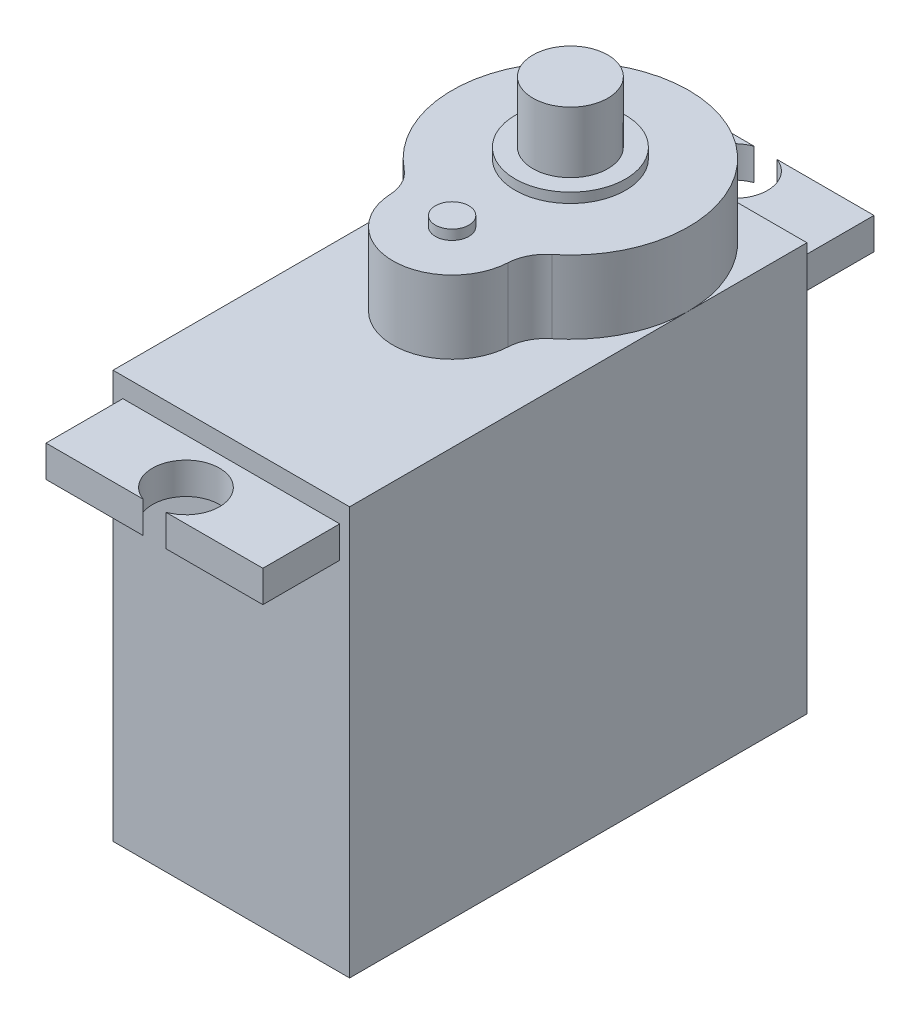
from build123d import *

# Parameters (mm, degrees)
SKETCH1_W                = 12
SKETCH1_H                = 23.2
BOSS_EXTRUDE1_DEPTH      = 20.7
SKETCH2_W                = 11
SKETCH2_H                = 1.6
BOSS_EXTRUDE2_DEPTH      = 3.9
SKETCH3_W                = 11
SKETCH3_H                = 1.6
BOSS_EXTRUDE3_DEPTH      = 3.9
SKETCH4_R                = 6
BOSS_EXTRUDE4_DEPTH      = 3.7
SKETCH5_R                = 3
BOSS_EXTRUDE5_DEPTH      = 3.7
FILLET1_R                = 2
SKETCH6_R                = 0.85
BOSS_EXTRUDE6_DEPTH      = 0.5
SKETCH7_R                = 2.8
BOSS_EXTRUDE7_DEPTH      = 0.5
SKETCH8_R                = 1.9
BOSS_EXTRUDE8_DEPTH      = 3.1
M3_CLEARANCE_HOLE1_D     = 3.4
M3_CLEARANCE_HOLE1_DEPTH = 3
M3_CLEARANCE_HOLE1_TIP   = 1.021463052
SKETCH11_R               = 0.5
BOSS_EXTRUDE9_DEPTH      = 3
LPATTERN2_COUNT          = 3
LPATTERN2_PITCH          = 1.01


with BuildPart() as part:
    # Sketch1 → Boss-Extrude1 (new body)
    with BuildSketch(Plane(origin=(0, 0, 0), x_dir=(1, 0, 0), z_dir=(0, 1, 0))):
        with Locations((6, 11.6)):
            Rectangle(SKETCH1_W, SKETCH1_H)
    extrude(amount=BOSS_EXTRUDE1_DEPTH)

    # Sketch2 → Boss-Extrude2 (add)
    with BuildSketch(Plane.XY):
        with Locations((6, 18.9)):
            Rectangle(SKETCH2_W, SKETCH2_H)
    extrude(amount=BOSS_EXTRUDE2_DEPTH)

    # Sketch3 → Boss-Extrude3 (add)
    with BuildSketch(Plane(origin=(0, 0, -23.2), x_dir=(-1, 0, 0), z_dir=(0, 0, -1))):
        with Locations((-6, 18.9)):
            Rectangle(SKETCH3_W, SKETCH3_H)
    extrude(amount=BOSS_EXTRUDE3_DEPTH)

    # Sketch4 → Boss-Extrude4 (add)
    with BuildSketch(Plane(origin=(0, 20.7, 0), x_dir=(1, 0, 0), z_dir=(0, 1, 0))):
        with Locations(Location((6, 17.2, 0), (0, 0, 90))):
            Circle(SKETCH4_R)
    extrude(amount=BOSS_EXTRUDE4_DEPTH)

    # Sketch5 → Boss-Extrude5 (add)
    with BuildSketch(Plane(origin=(0, 20.7, 0), x_dir=(1, 0, 0), z_dir=(0, 1, 0))):
        with Locations((6, 11.2)):
            Circle(SKETCH5_R)
    extrude(amount=BOSS_EXTRUDE5_DEPTH)

    # Fillet1
    fillet1_edges = [part.edges().sort_by_distance(p)[0] for p in [
        (3.09526249, 22.55, -11.95),
        (8.90473751, 22.55, -11.95),
    ]]
    fillet(fillet1_edges, radius=FILLET1_R)

    # Sketch6 → Boss-Extrude6 (add)
    with BuildSketch(Plane(origin=(0, 24.4, 0), x_dir=(1, 0, 0), z_dir=(0, 1, 0))):
        with Locations(Location((6, 11.2, 0), (0, 0, 270))):
            Circle(SKETCH6_R)
    extrude(amount=BOSS_EXTRUDE6_DEPTH)

    # Sketch7 → Boss-Extrude7 (add)
    with BuildSketch(Plane(origin=(0, 24.4, 0), x_dir=(1, 0, 0), z_dir=(0, 1, 0))):
        with Locations(Location((6, 17.2, 0), (0, 0, 270))):
            Circle(SKETCH7_R)
    extrude(amount=BOSS_EXTRUDE7_DEPTH)

    # Sketch8 → Boss-Extrude8 (add)
    with BuildSketch(Plane(origin=(0, 24.9, 0), x_dir=(1, 0, 0), z_dir=(0, 1, 0))):
        with Locations(Location((6, 17.2, 0), (0, 0, 90))):
            Circle(SKETCH8_R)
    extrude(amount=BOSS_EXTRUDE8_DEPTH)

    # M3 Clearance Hole1
    with Locations(Plane(origin=(0, 19.7, 0), x_dir=(1, 0, 0), z_dir=(0, 1, 0))):
        with Locations((6, -2.3), (6, 25.5)):
            Hole(M3_CLEARANCE_HOLE1_D / 2, depth=M3_CLEARANCE_HOLE1_DEPTH)
            with Locations((0, 0, -(M3_CLEARANCE_HOLE1_DEPTH + M3_CLEARANCE_HOLE1_TIP / 2))):  # 118° drill point
                Cone(0, M3_CLEARANCE_HOLE1_D / 2, M3_CLEARANCE_HOLE1_TIP, mode=Mode.SUBTRACT)

    # Sketch11 → Boss-Extrude9 (add)
    with BuildSketch(Plane(origin=(0, 0, -23.2), x_dir=(-1, 0, 0), z_dir=(0, 0, -1))):
        with Locations(Location((-7, 4.2, 0), (0, 0, 180))):
            Circle(SKETCH11_R)
    boss_extrude9 = extrude(amount=BOSS_EXTRUDE9_DEPTH)

    # LPattern2: Boss-Extrude9 ×3
    with Locations(*[(-i * LPATTERN2_PITCH, 0, 0) for i in range(1, LPATTERN2_COUNT)]):
        add(boss_extrude9)


solid = part.part
